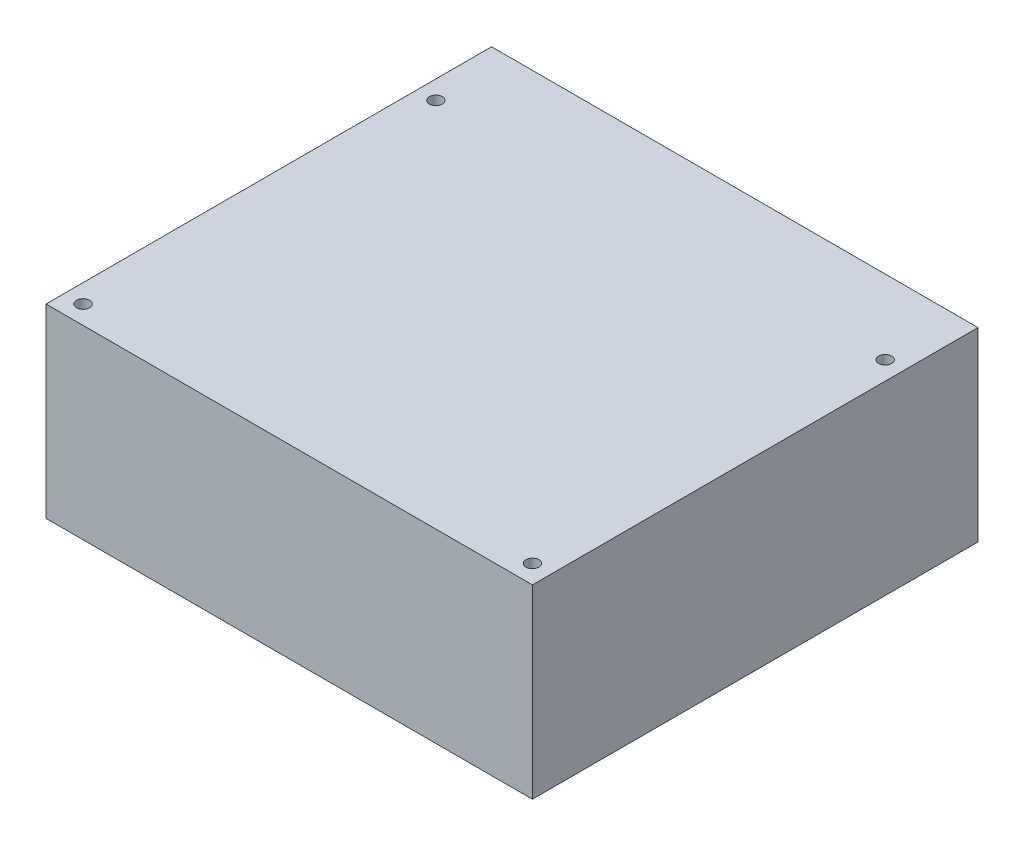
from build123d import *

# Parameters (mm, degrees)
SKETCH1_W           = 131
SKETCH1_H           = 120
SKETCH1_R           = 1.75
BOSS_EXTRUDE1_DEPTH = 50


with BuildPart() as part:
    # Sketch1 → Boss-Extrude1 (new body)
    with BuildSketch(Plane(origin=(0, 0, 0), x_dir=(1, 0, 0), z_dir=(0, 1, 0))):
        Rectangle(SKETCH1_W, SKETCH1_H)
        with Locations(Location((-60.5, -55, 0), (0, 0, 270))):
            Circle(SKETCH1_R, mode=Mode.SUBTRACT)
        with Locations(Location((60.5, -55, 0), (0, 0, 270))):
            Circle(SKETCH1_R, mode=Mode.SUBTRACT)
        with Locations(Location((60.5, 40, 0), (0, 0, 270))):
            Circle(SKETCH1_R, mode=Mode.SUBTRACT)
        with Locations(Location((-60.5, 40, 0), (0, 0, 270))):
            Circle(SKETCH1_R, mode=Mode.SUBTRACT)
    extrude(amount=BOSS_EXTRUDE1_DEPTH)


solid = part.part
